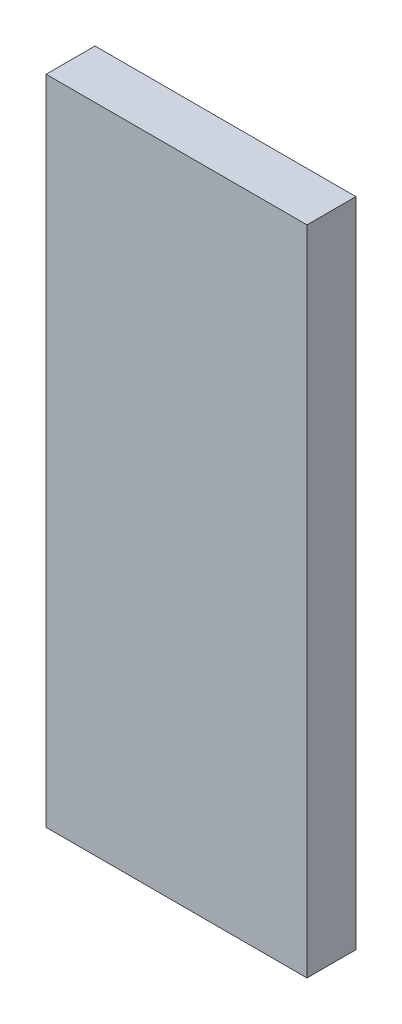
from build123d import *

# Parameters (mm, degrees)
BOSS_EXTRUDE1_DEPTH = 4.5


with BuildPart() as part:
    # Sketch1 → Boss-Extrude1 (new body)
    with BuildSketch(Plane.XY):
        Polygon((12, 0), (-12, 0), (-12, 60), (0, 60), (12, 60), align=None)
    extrude(amount=BOSS_EXTRUDE1_DEPTH)


solid = part.part
